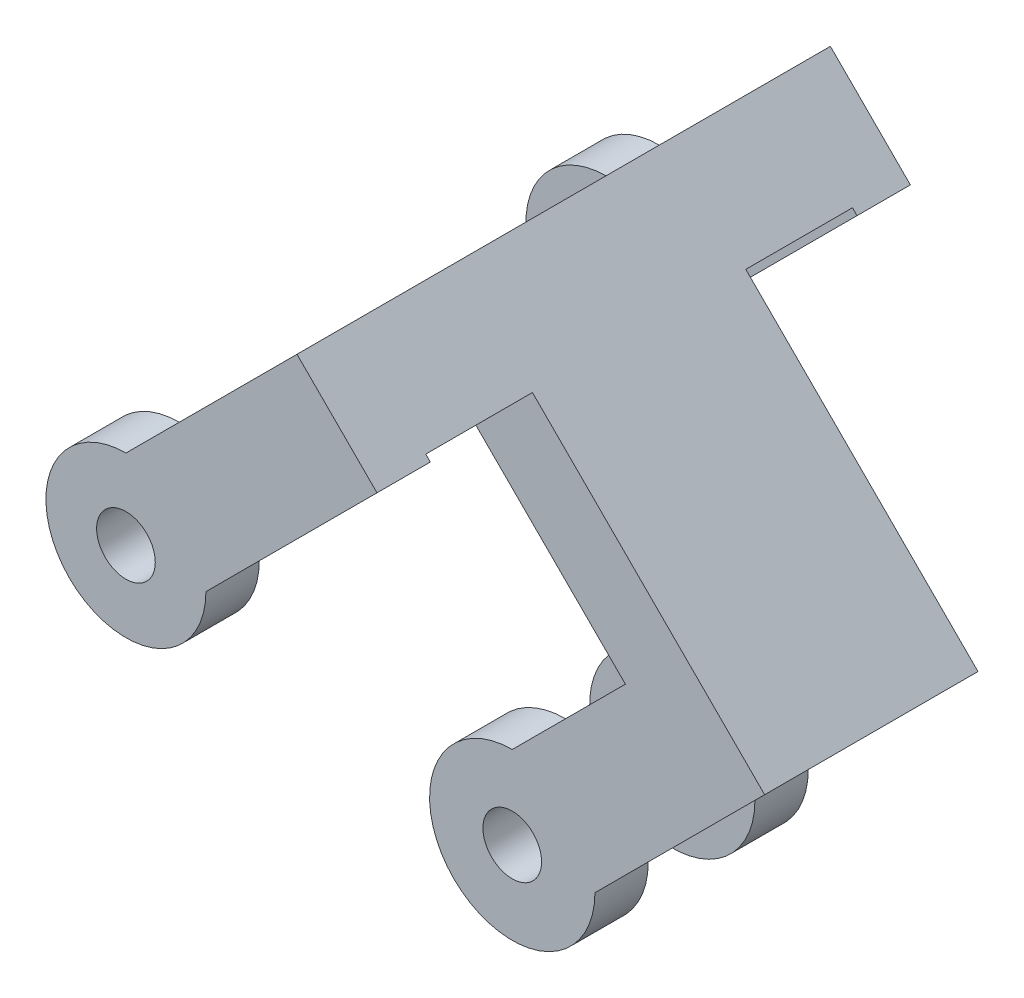
from build123d import *

# Parameters (mm, degrees)
SKETCH1_R            = 7.75
SKETCH1_R_2          = 2.75
BOSS_EXTRUDE1_DEPTH  = 5
SKETCH2_R            = 7.75
SKETCH2_R_2          = 2.75
BOSS_EXTRUDE2_DEPTH  = 5
SKETCH3_R            = 7.5
SKETCH3_R_2          = 2.75
BOSS_EXTRUDE4_DEPTH  = 5
BOSS_EXTRUDE5_DEPTH  = 5
SKETCH6_W            = 20
SKETCH6_H            = 40.783378413
BOSS_EXTRUDE6_DEPTH  = 10
SKETCH7_R            = 2.75
CUT_EXTRUDE1_DEPTH   = 10
SKETCH9_R            = 2.75
CUT_EXTRUDE2_DEPTH   = 389.276117932
BOSS_EXTRUDE7_DEPTH  = 15
BOSS_EXTRUDE8_DEPTH  = 15
SKETCH12_R           = 7.5
SKETCH12_R_2         = 2.75
BOSS_EXTRUDE9_DEPTH  = 5
BOSS_EXTRUDE10_START = -5
SKETCH13_R           = 2.75
BOSS_EXTRUDE10_DEPTH = 5
CUT_EXTRUDE3_DEPTH   = 5
BOSS_EXTRUDE11_DEPTH = 2.5


with BuildPart() as part:
    # Sketch1 → Boss-Extrude1 (new body)
    with BuildSketch(Plane.XY):
        with Locations((-68.786796564, 328.786796564)):
            Circle(SKETCH1_R)
        with Locations((-68.786796564, 328.786796564)):
            Circle(SKETCH1_R_2, mode=Mode.SUBTRACT)
    extrude(amount=BOSS_EXTRUDE1_DEPTH)

    # Sketch4 → Boss-Extrude5 (add)
    with BuildSketch(Plane.XY):
        with BuildLine():
            Line((-61.036796564, 328.786796564), (-43.359127035, 346.464466094))
            Line((-43.359127035, 346.464466094), (-72.19733047, 375.30266953))
            Line((-72.19733047, 375.30266953), (-90, 357.5))
            ThreePointArc((-90, 357.5), (-95.303300859, 344.696699141), (-82.5, 350))
            Line((-82.5, 350), (-69.647077939, 362.852922061))
            Line((-69.647077939, 362.852922061), (-56.058874503, 349.264718626))
            Line((-56.058874503, 349.264718626), (-68.786796564, 336.536796564))
            ThreePointArc((-68.786796564, 336.536796564), (-74.266874119, 323.30671901), (-61.036796564, 328.786796564))
        make_face()
    extrude(amount=BOSS_EXTRUDE5_DEPTH)



with BuildPart() as body_2:
    # Sketch2 → Boss-Extrude2 (new body)
    with BuildSketch(Plane(origin=(0, 0, -10), x_dir=(-1, 0, 0), z_dir=(0, 0, -1))):
        with Locations((68.786796564, 328.786796564)):
            Circle(SKETCH2_R)
        with Locations((68.786796564, 328.786796564)):
            Circle(SKETCH2_R_2, mode=Mode.SUBTRACT)
    extrude(amount=BOSS_EXTRUDE2_DEPTH)

    # Sketch3 → Boss-Extrude4 (add)
    # profile 1 of 2: a face of its own
    with BuildSketch(Plane(origin=(0, 0, -15), x_dir=(-1, 0, 0), z_dir=(0, 0, -1))):
        with Locations((90, 350)):
            Circle(SKETCH3_R)
        with Locations((90, 350)):
            Circle(SKETCH3_R_2, mode=Mode.SUBTRACT)
    # profile 2 of 2: a face of its own
    with BuildSketch(Plane(origin=(0, 0, -15), x_dir=(-1, 0, 0), z_dir=(0, 0, -1))):
        with BuildLine():
            Line((43.359127035, 346.464466094), (61.036796564, 328.786796564))
            ThreePointArc((61.036796564, 328.786796564), (63.30671901, 334.266874119), (68.786796564, 336.536796564))
            Line((68.786796564, 336.536796564), (56.058874503, 349.264718626))
            Line((56.058874503, 349.264718626), (69.647077939, 362.852922061))
            Line((69.647077939, 362.852922061), (82.5, 350))
            ThreePointArc((82.5, 350), (84.696699141, 355.303300859), (90, 357.5))
            Line((90, 357.5), (72.19733047, 375.30266953))
            Line((72.19733047, 375.30266953), (43.359127035, 346.464466094))
        make_face()
    extrude(amount=-BOSS_EXTRUDE4_DEPTH)


with BuildPart() as part_1:
    add(part.part)

    add(body_2.part)  # Boss-Extrude6 merges body 2
    # Sketch6 → Boss-Extrude6 (add)
    with BuildSketch(Plane(origin=(151.55266953, 151.55266953, 0), x_dir=(0, 0, -1), z_dir=(0.7071067811865483, 0.7071067811865468, 0))):
        with Locations((5, 296.038595375)):
            Rectangle(SKETCH6_W, SKETCH6_H)
    extrude(amount=-BOSS_EXTRUDE6_DEPTH)

    # Sketch7 → Cut-Extrude1 (cut)
    with BuildSketch(Plane.XY.offset(5)):
        with Locations(Location((-68.786796564, 328.786796564, 0), (0, 0, 180))):
            Circle(SKETCH7_R)
        with Locations(Location((-90, 350, 0), (0, 0, 180))):
            Circle(SKETCH7_R)
    extrude(amount=-CUT_EXTRUDE1_DEPTH, mode=Mode.SUBTRACT)

    # Sketch9 → Cut-Extrude2 (cut, through all)
    with BuildSketch(Plane.XY.offset(5)):
        with BuildLine():
            Line((-82.5, 350), (-71.768398282, 360.731601718))
            Line((-71.768398282, 360.731601718), (-79.268398282, 368.231601718))
            Line((-79.268398282, 368.231601718), (-90, 357.5))
            ThreePointArc((-90, 357.5), (-95.303300859, 344.696699141), (-82.5, 350))
        make_face()
        with Locations((-90, 350)):
            Circle(SKETCH9_R, mode=Mode.SUBTRACT)
    extrude(amount=-CUT_EXTRUDE2_DEPTH, mode=Mode.SUBTRACT)

    # Sketch10 → Boss-Extrude7 (add)
    with BuildSketch(Plane.XY.offset(5)):
        Polygon((-72.19733047, 361.160533906), (-65.126262658, 368.231601718), (-72.19733047, 375.30266953), (-79.268398282, 368.231601718), align=None)
    extrude(amount=BOSS_EXTRUDE7_DEPTH)

    # Sketch11 → Boss-Extrude8 (add)
    with BuildSketch(Plane(origin=(0, 0, -15), x_dir=(-1, 0, 0), z_dir=(0, 0, -1))):
        Polygon((65.126262658, 368.231601718), (72.19733047, 361.160533906), (79.268398282, 368.231601718), (72.19733047, 375.30266953), align=None)
    extrude(amount=BOSS_EXTRUDE8_DEPTH)

    # Sketch12 → Boss-Extrude9 (add)
    # profile 1 of 3: a face of its own
    with BuildSketch(Plane.XY.offset(20)):
        with BuildLine():
            Line((-82.5, 350), (-71.768398282, 360.731601718))
            Line((-71.768398282, 360.731601718), (-72.19733047, 361.160533906))
            Line((-72.19733047, 361.160533906), (-79.268398282, 368.231601718))
            Line((-79.268398282, 368.231601718), (-90, 357.5))
            ThreePointArc((-90, 357.5), (-84.696699141, 355.303300859), (-82.5, 350))
        make_face()
    # profile 2 of 3: a face of its own
    with BuildSketch(Plane.XY.offset(20)):
        with Locations((-90, 350)):
            Circle(SKETCH12_R)
        with Locations((-90, 350)):
            Circle(SKETCH12_R_2, mode=Mode.SUBTRACT)
    # profile 3 of 3: a face of its own
    with BuildSketch(Plane.XY.offset(20)):
        Polygon((-72.19733047, 361.160533906), (-71.768398282, 360.731601718), (-64.69733047, 367.80266953), (-65.126262658, 368.231601718), align=None)
    extrude(amount=-BOSS_EXTRUDE9_DEPTH)

    # Sketch13 → Boss-Extrude10 (add)
    with BuildSketch(Plane(origin=(0, 0, -30), x_dir=(-1, 0, 0), z_dir=(0, 0, -1)).offset(BOSS_EXTRUDE10_START)):
        with BuildLine():
            Line((90, 357.5), (79.268398282, 368.231601718))
            Line((79.268398282, 368.231601718), (72.19733047, 361.160533906))
            Line((72.19733047, 361.160533906), (65.126262658, 368.231601718))
            Line((65.126262658, 368.231601718), (64.69733047, 367.80266953))
            Line((64.69733047, 367.80266953), (82.5, 350))
            ThreePointArc((82.5, 350), (95.303300859, 344.696699141), (90, 357.5))
        make_face()
        with Locations(Location((90, 350, 0), (0, 0, 180))):
            Circle(SKETCH13_R, mode=Mode.SUBTRACT)
    extrude(amount=BOSS_EXTRUDE10_DEPTH)

    # Sketch14 → Cut-Extrude3 (cut)
    with BuildSketch(Plane(origin=(151.55266953, 151.55266953, 0), x_dir=(0, 0, -1), z_dir=(0.7071067811865476, 0.7071067811865476, 0))):
        Polygon((-5, 275.646906168), (15, 275.646906168), (15, 306.430284581), (25, 306.430284581), (25, 305.823682863), (30, 305.823682863), (30, 316.430284581), (-20, 316.430284581), (-20, 305.823682863), (-15, 305.823682863), (-15, 306.430284581), (-5, 306.430284581), align=None)
    extrude(amount=-CUT_EXTRUDE3_DEPTH, mode=Mode.SUBTRACT)

    # Sketch15 → Boss-Extrude11 (add)
    with BuildSketch(Plane(origin=(148.017135624, 148.017135624, 0), x_dir=(0, 0, -1), z_dir=(0.7071067811865477, 0.7071067811865475, 0))):
        Polygon((-5, 306.430284581), (-5, 275.646906168), (15, 275.646906168), (15, 306.430284581), (25, 306.430284581), (25, 305.823682863), (30, 305.823682863), (30, 316.430284581), (-20, 316.430284581), (-20, 305.823682863), (-15, 305.823682863), (-15, 306.430284581), align=None)
    extrude(amount=BOSS_EXTRUDE11_DEPTH)


solid = part_1.part
